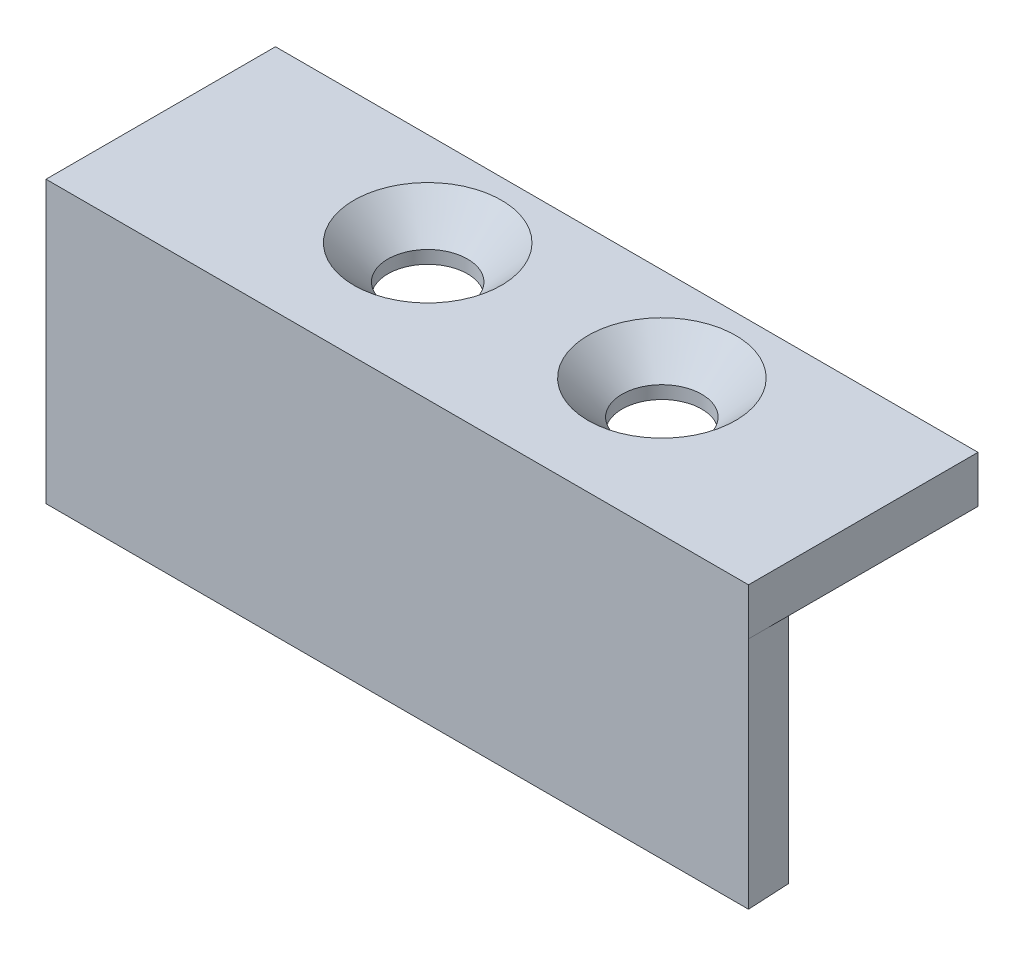
from build123d import *

# Parameters (mm, degrees)
SKIZZE1_W                                            = 30
SKIZZE1_H                                            = 9.8
AUFSATZ_LINEAR_AUSTRAGEN1_DEPTH                      = 2
FORMSENKUNG_F_R_M3_LINSENSENKSCHRAUBE_MI_D           = 3.4
FORMSENKUNG_F_R_M3_LINSENSENKSCHRAUBE_MI_DEPTH       = 8.5
FORMSENKUNG_F_R_M3_LINSENSENKSCHRAUBE_MI_CSINK_D     = 6.3
FORMSENKUNG_F_R_M3_LINSENSENKSCHRAUBE_MI_CSINK_ANGLE = 90
FORMSENKUNG_F_R_M3_LINSENSENKSCHRAUBE_MI_TIP         = 1.021463052
AUFSATZ_LINEAR_AUSTRAGEN2_DEPTH                      = 10


with BuildPart() as part:
    # Skizze1 → Aufsatz-Linear austragen1 (new body)
    with BuildSketch(Plane(origin=(0, 0, 0), x_dir=(1, 0, 0), z_dir=(0, 1, 0))):
        with Locations((5, 8.1)):
            Rectangle(SKIZZE1_W, SKIZZE1_H)
    extrude(amount=AUFSATZ_LINEAR_AUSTRAGEN1_DEPTH)

    # Formsenkung für M3 Linsensenkschraube mit Schlitz1
    with Locations(Plane(origin=(0, 2, 0), x_dir=(1, 0, 0), z_dir=(0, 1, 0))):
        with Locations((0.5, 9), (10.5, 9)):
            CounterSinkHole(FORMSENKUNG_F_R_M3_LINSENSENKSCHRAUBE_MI_D / 2, FORMSENKUNG_F_R_M3_LINSENSENKSCHRAUBE_MI_CSINK_D / 2, depth=FORMSENKUNG_F_R_M3_LINSENSENKSCHRAUBE_MI_DEPTH, counter_sink_angle=FORMSENKUNG_F_R_M3_LINSENSENKSCHRAUBE_MI_CSINK_ANGLE)
            with Locations((0, 0, -(FORMSENKUNG_F_R_M3_LINSENSENKSCHRAUBE_MI_DEPTH + FORMSENKUNG_F_R_M3_LINSENSENKSCHRAUBE_MI_TIP / 2))):  # 118° drill point
                Cone(0, FORMSENKUNG_F_R_M3_LINSENSENKSCHRAUBE_MI_D / 2, FORMSENKUNG_F_R_M3_LINSENSENKSCHRAUBE_MI_TIP, mode=Mode.SUBTRACT)

    # Skizze13 → Aufsatz-Linear austragen2 (add)
    with BuildSketch(Plane.XZ):
        Polygon((-10, -3.2), (-10, -4.99756301), (19.906366545, -4.99756301), (20, -3.2), align=None)
    extrude(amount=AUFSATZ_LINEAR_AUSTRAGEN2_DEPTH)


solid = part.part
